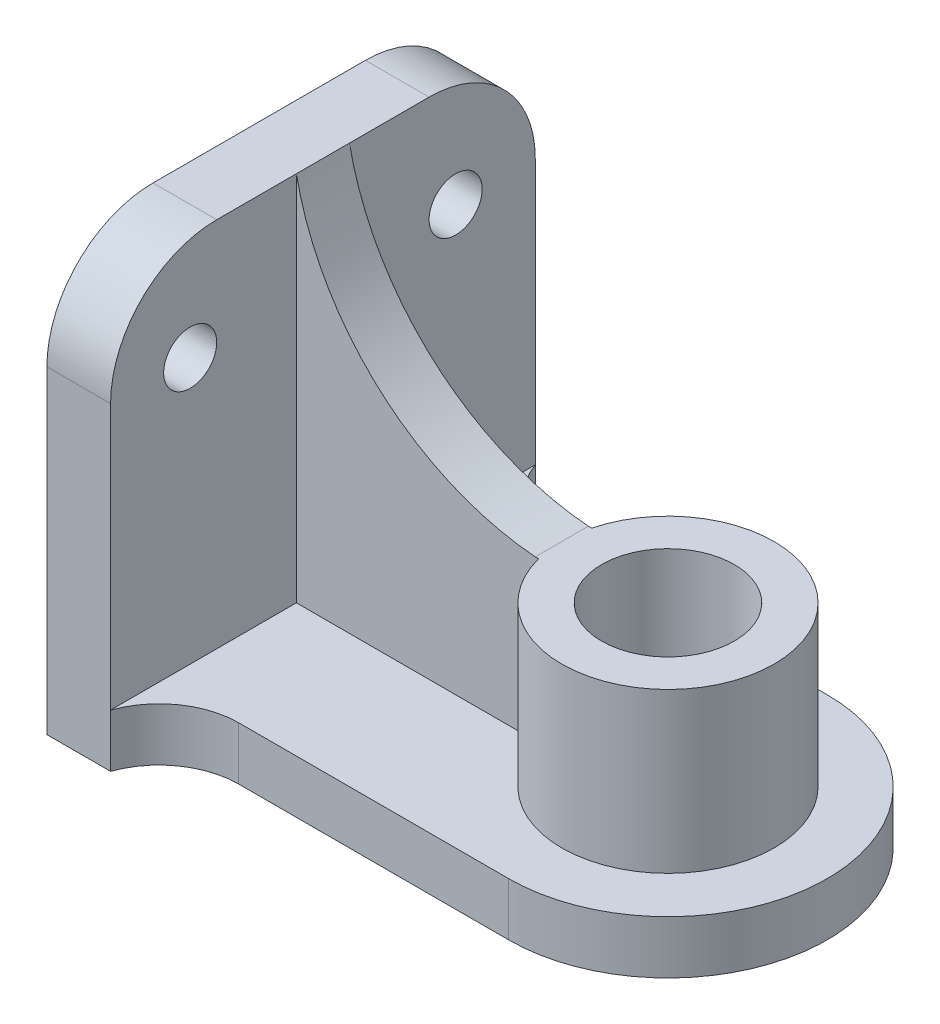
from build123d import *

# Parameters (mm, degrees)
SKETCH1_R            = 20
BOSS_EXTRUDE3_DEPTH  = 10
SKETCH1_6_W          = 12
SKETCH1_6_H          = 80
BOSS_EXTRUDE4_DEPTH  = 80
FILLET1_R            = 20
SKETCH1_8_R          = 20
SKETCH1_8_R_2        = 12.5
BOSS_EXTRUDE5_DEPTH  = 40
BOSS_EXTRUDE11_DEPTH = 5
SKETCH12_R           = 5
CUT_EXTRUDE1_DEPTH   = 148.732867027


with BuildPart() as part:
    # Sketch1 → Boss-Extrude3 (new body)
    with BuildSketch(Plane(origin=(0, 0, 0), x_dir=(1, 0, 0), z_dir=(0, 1, 0))):
        with BuildLine():
            ThreePointArc((26.142135624, -10), (17.481881586, -7.247448714), (12, 0))
            Line((12, 0), (12, -80))
            ThreePointArc((12, -80), (17.481881586, -72.752551286), (26.142135624, -70))
            Line((26.142135624, -70), (77, -70))
            ThreePointArc((77, -70), (107, -40), (77, -10))
            Line((77, -10), (26.142135624, -10))
        make_face()
        with Locations((77, -40)):
            Circle(SKETCH1_R, mode=Mode.SUBTRACT)
    extrude(amount=BOSS_EXTRUDE3_DEPTH)

    # Sketch1<6> → Boss-Extrude4 (add)
    with BuildSketch(Plane(origin=(0, 0, 0), x_dir=(1, 0, 0), z_dir=(0, 1, 0))):
        with Locations((6, -40)):
            Rectangle(SKETCH1_6_W, SKETCH1_6_H)
    extrude(amount=BOSS_EXTRUDE4_DEPTH)

    # Fillet1
    fillet1_edges = [part.edges().sort_by_distance(p)[0] for p in [
        (6, 80, 0),
        (6, 80, 80),
    ]]
    fillet(fillet1_edges, radius=FILLET1_R)

    # Sketch1<8> → Boss-Extrude5 (add)
    with BuildSketch(Plane(origin=(0, 0, 0), x_dir=(1, 0, 0), z_dir=(0, 1, 0))):
        with Locations((77, -40)):
            Circle(SKETCH1_8_R)
        with Locations((77, -40)):
            Circle(SKETCH1_8_R_2, mode=Mode.SUBTRACT)
    extrude(amount=BOSS_EXTRUDE5_DEPTH)

    # Sketch11 → Boss-Extrude11 (add, symmetric)
    with BuildSketch(Plane.XY.offset(40)):
        with BuildLine():
            Line((12, 80), (12, 10))
            Line((12, 10), (57, 10))
            Line((57, 10), (64.5, 10))
            Line((64.5, 10), (64.5, 40))
            Line((64.5, 40), (57, 40))
            ThreePointArc((57, 40), (27.804407401, 52.467458326), (12, 80))
        make_face()
    extrude(amount=BOSS_EXTRUDE11_DEPTH, both=True)

    # Sketch12 → Cut-Extrude1 (cut, through all)
    with BuildSketch(Plane(origin=(12, 0, 0), x_dir=(0, 0, -1), z_dir=(1, 0, 0))):
        with Locations((-65, 60)):
            Circle(SKETCH12_R)
        with Locations((-15, 60)):
            Circle(SKETCH12_R)
    extrude(amount=-CUT_EXTRUDE1_DEPTH, mode=Mode.SUBTRACT)


solid = part.part
